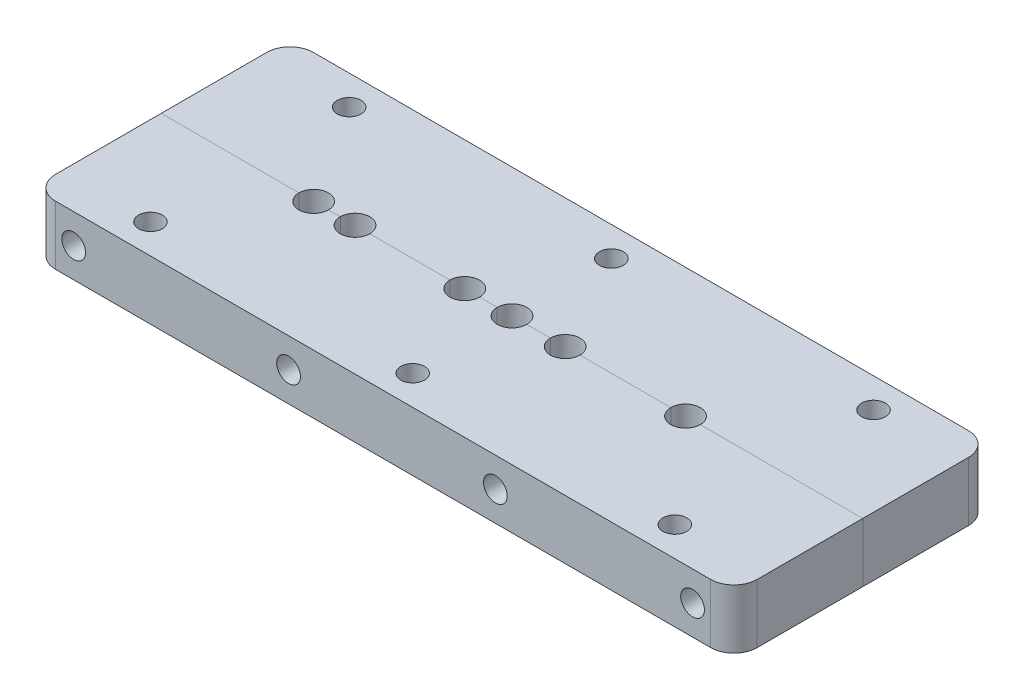
from build123d import *

# Parameters (mm, degrees)
SKETCH1_W              = 150.8
SKETCH1_H              = 55.4
BOSS_EXTRUDE1_DEPTH    = 12.7
FILLET1_R              = 5
F_10_CLEARANCE_HOLE1_D = 5.1054
BOSS_EXTRUDE2_START    = -12.7
SKETCH5_R              = 3.175
BOSS_EXTRUDE2_DEPTH    = 12.7
F_10_CLEARANCE_HOLE2_D = 5.1054


with BuildPart() as part:
    # Sketch1 → Boss-Extrude1 (new body)
    with BuildSketch(Plane(origin=(0, 0, 0), x_dir=(1, 0, 0), z_dir=(0, 1, 0))):
        Rectangle(SKETCH1_W, SKETCH1_H)
        with BuildLine():
            Line((45, 15), (-45, 15))
            ThreePointArc((-45, 15), (-48.535533906, 13.535533906), (-50, 10))
            Line((-50, 10), (-50, -10))
            ThreePointArc((-50, -10), (-48.535533906, -13.535533906), (-45, -15))
            Line((-45, -15), (45, -15))
            ThreePointArc((45, -15), (48.535533906, -13.535533906), (50, -10))
            Line((50, -10), (50, 10))
            ThreePointArc((50, 10), (48.535533906, 13.535533906), (45, 15))
        make_face(mode=Mode.SUBTRACT)
    extrude(amount=BOSS_EXTRUDE1_DEPTH)

    # Fillet1
    fillet1_edges = [part.edges().sort_by_distance(p)[0] for p in [
        (75.4, 6.35, 27.7),
        (-75.4, 6.35, 27.7),
        (-75.4, 6.35, -27.7),
        (75.4, 6.35, -27.7),
    ]]
    fillet(fillet1_edges, radius=FILLET1_R)

    # #10 Clearance Hole1 (through all)
    with Locations(Plane(origin=(0, 0, 0), x_dir=(-1, 0, 0), z_dir=(0, -1, 0))):
        with Locations((56.35, 21.35), (0, 21.35), (-56.35, 21.35), (-56.35, -21.35), (0, -21.35), (56.35, -21.35)):
            Hole(F_10_CLEARANCE_HOLE1_D / 2)

    # Sketch5 → Boss-Extrude2 (add)
    with BuildSketch(Plane(origin=(0, 12.7, 0), x_dir=(1, 0, 0), z_dir=(0, 1, 0)).offset(BOSS_EXTRUDE2_START)):
        with BuildLine():
            Line((-50, 10), (-50, -10))
            ThreePointArc((-50, -10), (-48.535533906, -13.535533906), (-45, -15))
            Line((-45, -15), (45, -15))
            ThreePointArc((45, -15), (48.535533906, -13.535533906), (50, -10))
            Line((50, -10), (50, 10))
            ThreePointArc((50, 10), (48.535533906, 13.535533906), (45, 15))
            Line((45, 15), (-45, 15))
            ThreePointArc((-45, 15), (-48.535533906, 13.535533906), (-50, 10))
        make_face()
        with Locations(Location((-42.626400921, 0, 0), (0, 0, 270))):
            Circle(SKETCH5_R, mode=Mode.SUBTRACT)
        with Locations(Location((-33.736400921, 0, 0), (0, 0, 270))):
            Circle(SKETCH5_R, mode=Mode.SUBTRACT)
        with Locations(Location((-10.16, 0, 0), (0, 0, 270))):
            Circle(SKETCH5_R, mode=Mode.SUBTRACT)
        with Locations(Location((0, 0, 0), (0, 0, 270))):
            Circle(SKETCH5_R, mode=Mode.SUBTRACT)
        with Locations(Location((37.3, 0, 0), (0, 0, 270))):
            Circle(SKETCH5_R, mode=Mode.SUBTRACT)
        with Locations(Location((11.43, 0, 0), (0, 0, 270))):
            Circle(SKETCH5_R, mode=Mode.SUBTRACT)
    extrude(amount=BOSS_EXTRUDE2_DEPTH)

    # #10 Clearance Hole2 (through all)
    with Locations(Plane.XY.offset(27.7)):
        with Locations((66.51, 6.35), (-66.51, 6.35), (-20.32, 6.35), (24.13, 6.35)):
            Hole(F_10_CLEARANCE_HOLE2_D / 2)


with BuildPart() as body_2:
    # Split2: the piece on the far side of the plane
    add(part.part)
    split(bisect_by=Plane.XY, keep=Keep.BOTTOM)


with BuildPart() as part_1:
    add(part.part)

    # Split2
    split(bisect_by=Plane.XY, keep=Keep.TOP)


solid = Compound([body_2.part, part_1.part])
